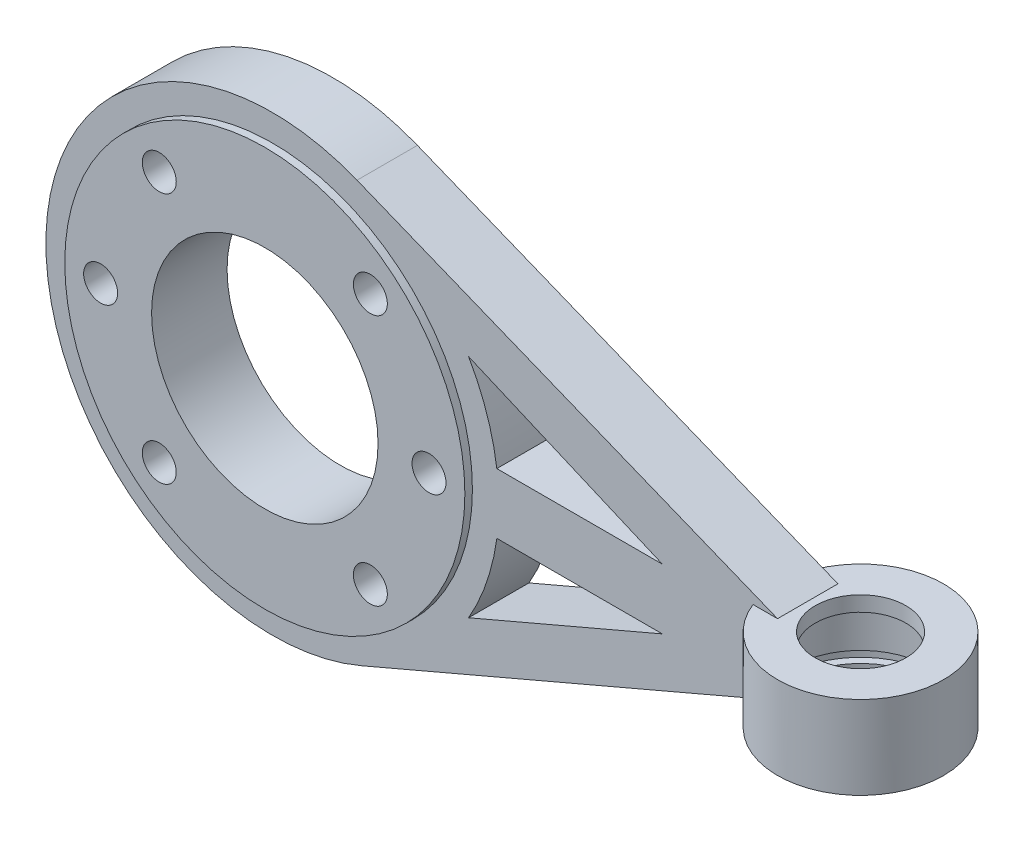
from build123d import *

# Parameters (mm, degrees)
SKETCH_1_R               = 30
EXTRUDE_1_DEPTH          = 3
SKETCH_2_W               = 11
SKETCH_2_H               = 11
EXTRUDE_2_DEPTH          = 4
SKETCH_4_R               = 6
CUT_EXTRUDE_1_DEPTH      = 25
SKETCH_5_R               = 9
CUT_EXTRUDE_2_DEPTH      = 9
CUT_EXTRUDE_START        = 8
SKETCH_6_R               = 10
SKETCH_6_R_2             = 9
CUT_EXTRUDE_3_DEPTH      = 1.5
SKETCH_8_R               = 26.5
EXTRUDE_3_DEPTH          = 5
CUT_EXTRUDE_4_DEPTH      = 92.299851037
CUT_EXTRUDE_4_DEPTH_BACK = 92.299851037
SKETCH_7_R               = 15
SKETCH_10_R              = 2.25
CUT_EXTRUDE_5_DEPTH      = 17


with BuildPart() as part:
    # 草图1 → 凸台-拉伸1 (new body)
    with BuildSketch(Plane.XY):
        Circle(SKETCH_1_R)
    extrude(amount=EXTRUDE_1_DEPTH)



with BuildPart() as body_2:
    # 草图2 → 旋转1 (revolve)
    with BuildSketch(Plane.XY.offset(3)):
        with Locations((68.415621645, -0.125)):
            Rectangle(SKETCH_2_W, SKETCH_2_H)
    revolve(axis=Axis((73.915621645, 22.717290725, 3), (0, -1, 0)))


with BuildPart() as part_1:
    add(part.part)

    add(body_2.part)  # 凸台-拉伸2 merges body 2
    # 草图3 → 凸台-拉伸2 (add, symmetric)
    with BuildSketch(Plane.XY.offset(3)):
        with BuildLine():
            Line((11.214731114, 27.824985284), (66.915621645, 5.375))
            Line((66.915621645, 5.375), (66.915621645, -4))
            Line((66.915621645, -4), (11.80104521, -27.581430926))
            ThreePointArc((11.80104521, -27.581430926), (-29.998320441, -0.317444067), (11.214731114, 27.824985284))
        make_face()
    extrude(amount=EXTRUDE_2_DEPTH, both=True)

    # 草图4 → 切除-拉伸1 (cut)
    with BuildSketch(Plane.XZ.offset(5.625)):
        with Locations(Location((73.915621645, 3, 0), (0, 0, 270))):
            Circle(SKETCH_4_R)
    extrude(amount=-CUT_EXTRUDE_1_DEPTH, mode=Mode.SUBTRACT)

    # 草图5 → 切除-拉伸2 (cut)
    with BuildSketch(Plane.XZ.offset(5.625)):
        with Locations(Location((73.915621645, 3, 0), (0, 0, 270))):
            Circle(SKETCH_5_R)
    extrude(amount=-CUT_EXTRUDE_2_DEPTH, mode=Mode.SUBTRACT)

    # 草图6 → 切除-拉伸3 (cut)
    # profile 1 of 2: a face of its own
    with BuildSketch(Plane.XZ.offset(-3.375).offset(CUT_EXTRUDE_START)):
        with Locations(Location((73.915621645, 3, 0), (0, 0, 270))):
            Circle(SKETCH_6_R)
        with Locations(Location((73.915621645, 3, 0), (0, 0, 270))):
            Circle(SKETCH_6_R_2, mode=Mode.SUBTRACT)
    # profile 2 of 2: a face of its own
    with BuildSketch(Plane.XZ.offset(-3.375).offset(CUT_EXTRUDE_START)):
        with Locations(Location((73.915621645, 3, 0), (0, 0, 270))):
            Circle(SKETCH_6_R_2)
    extrude(amount=-CUT_EXTRUDE_3_DEPTH, mode=Mode.SUBTRACT)

    # 草图8 → 凸台-拉伸3 (add, symmetric)
    with BuildSketch(Plane(origin=(0, 0, 3), x_dir=(-1, 0, 0), z_dir=(0, 0, -1))):
        with Locations(Location((0, 0, 0), (0, 0, 180))):
            Circle(SKETCH_8_R)
    extrude(amount=EXTRUDE_3_DEPTH, both=True)

    # 草图7 → 切除-拉伸4 (cut, two sides: drawn at the far end of the back side and taken through both)
    with BuildSketch(Plane.XY.offset(7).offset(-CUT_EXTRUDE_4_DEPTH_BACK)):
        with Locations(Location((0, 0, 0), (0, 0, 180))):
            Circle(SKETCH_7_R)
        with BuildLine():
            Line((25.989694724, -14.984517615), (51.662735414, -4))
            Line((51.662735414, -4), (29.732137495, -4))
            ThreePointArc((29.732137495, -4), (28.397104663, -9.674939108), (25.989694724, -14.984517615))
        make_face()
        with BuildLine():
            Line((29.732137495, 4), (51.662735414, 4))
            Line((51.662735414, 4), (25.989694724, 14.984517615))
            ThreePointArc((25.989694724, 14.984517615), (28.397104663, 9.674939108), (29.732137495, 4))
        make_face()
    extrude(amount=CUT_EXTRUDE_4_DEPTH + CUT_EXTRUDE_4_DEPTH_BACK, mode=Mode.SUBTRACT)

    # 草图10 → 切除-拉伸5 (cut)
    with BuildSketch(Plane.XY.offset(8)):
        with Locations((21.75, 0)):
            Circle(SKETCH_10_R)
        with Locations((13.980630511, -16.661466638)):
            Circle(SKETCH_10_R)
        with Locations(Location((-21.75, 0, 0), (0, 0, 180))):
            Circle(SKETCH_10_R)
        with Locations(Location((-13.980630511, -16.661466638, 0), (0, 0, 180))):
            Circle(SKETCH_10_R)
        with Locations(Location((13.980630511, 16.661466638, 0), (0, 0, 180))):
            Circle(SKETCH_10_R)
        with Locations((-13.980630511, 16.661466638)):
            Circle(SKETCH_10_R)
    extrude(amount=-CUT_EXTRUDE_5_DEPTH, mode=Mode.SUBTRACT)


solid = part_1.part
